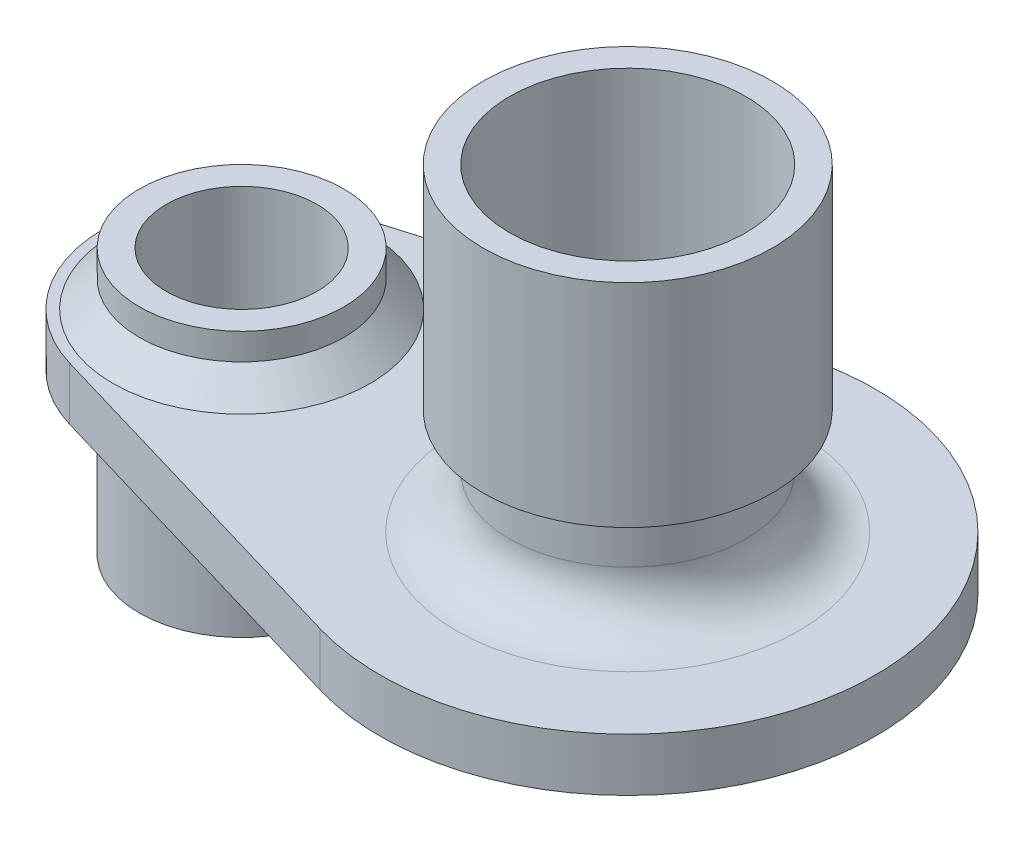
from build123d import *

# Parameters (mm, degrees)
BOSS_EXTRUDE1_DEPTH = 25.4
SKETCH2_R           = 97.917
BOSS_EXTRUDE2_DEPTH = 152.4
SKETCH3_R           = 72.263
CUT_EXTRUDE2_DEPTH  = 683.710043354
BOSS_EXTRUDE3_START = -254
SKETCH4_R           = 97.917
BOSS_EXTRUDE3_DEPTH = 254
SKETCH3_3_R         = 72.263
CUT_EXTRUDE3_DEPTH  = 254
SKETCH5_R           = 113.157
BOSS_EXTRUDE5_DEPTH = 101.6
SKETCH8_R           = 138.557
SKETCH8_R_2         = 113.157
BOSS_EXTRUDE6_DEPTH = 203.2
SKETCH9_R           = 38.1
CUT_EXTRUDE6_DEPTH  = 720.517757457
FILLET1_R           = 50.8
CHAMFER1_SIZE       = 25.4


with BuildPart() as part:
    # Sketch1 → Boss-Extrude1 (new, symmetric)
    with BuildSketch(Plane(origin=(0, 0, 0), x_dir=(1, 0, 0), z_dir=(0, 1, 0))):
        with BuildLine():
            Line((-37.518032967, 127.16908015), (302.694032967, 227.540078277))
            ThreePointArc((302.694032967, 227.540078277), (607.06, 0), (302.694032967, -227.540078277))
            Line((302.694032967, -227.540078277), (-37.518032967, -127.16908015))
            ThreePointArc((-37.518032967, -127.16908015), (-132.588, 0), (-37.518032967, 127.16908015))
        make_face()
    extrude(amount=BOSS_EXTRUDE1_DEPTH, both=True)

    # Sketch2 → Boss-Extrude2 (add)
    with BuildSketch(Plane.XZ.offset(25.4)):
        Circle(SKETCH2_R)
    extrude(amount=BOSS_EXTRUDE2_DEPTH)

    # Sketch3 → Cut-Extrude2 (cut, through all)
    with BuildSketch(Plane.XZ.offset(177.8)):
        Circle(SKETCH3_R)
    extrude(amount=-CUT_EXTRUDE2_DEPTH, mode=Mode.SUBTRACT)

    # Sketch4 → Boss-Extrude3 (add)
    with BuildSketch(Plane.XZ.offset(177.8).offset(BOSS_EXTRUDE3_START)):
        Circle(SKETCH4_R)
    extrude(amount=BOSS_EXTRUDE3_DEPTH)

    # Sketch3<3> → Cut-Extrude3 (cut)
    with BuildSketch(Plane.XZ.offset(177.8)):
        Circle(SKETCH3_3_R)
    extrude(amount=-CUT_EXTRUDE3_DEPTH, mode=Mode.SUBTRACT)

    # Sketch5 → Boss-Extrude5 (add)
    with BuildSketch(Plane(origin=(0, 25.4, 0), x_dir=(1, 0, 0), z_dir=(0, 1, 0))):
        with Locations((369.824, 0)):
            Circle(SKETCH5_R)
    extrude(amount=BOSS_EXTRUDE5_DEPTH)

    # Sketch9 → Cut-Extrude6 (cut, through all)
    with BuildSketch(Plane(origin=(0, 127, 0), x_dir=(1, 0, 0), z_dir=(0, 1, 0))):
        with Locations((369.824, 0)):
            Circle(SKETCH9_R)
    extrude(amount=-CUT_EXTRUDE6_DEPTH, mode=Mode.SUBTRACT)

    # Fillet1
    fillet1_edges = [part.edges().sort_by_distance(p)[0] for p in [
        (256.667, 25.4, 0),
    ]]
    fillet(fillet1_edges, radius=FILLET1_R)

    # Chamfer1
    chamfer1_edges = [part.edges().sort_by_distance(p)[0] for p in [
        (-97.917, 25.4, 0),
    ]]
    chamfer(chamfer1_edges, length=CHAMFER1_SIZE)


with BuildPart() as body_2:
    # Sketch8 → Boss-Extrude6 (new body)
    with BuildSketch(Plane(origin=(0, 127, 0), x_dir=(1, 0, 0), z_dir=(0, 1, 0))):
        with Locations((369.824, 0)):
            Circle(SKETCH8_R)
        with Locations((369.824, 0)):
            Circle(SKETCH8_R_2, mode=Mode.SUBTRACT)
    extrude(amount=BOSS_EXTRUDE6_DEPTH)


solid = Compound([part.part, body_2.part])
